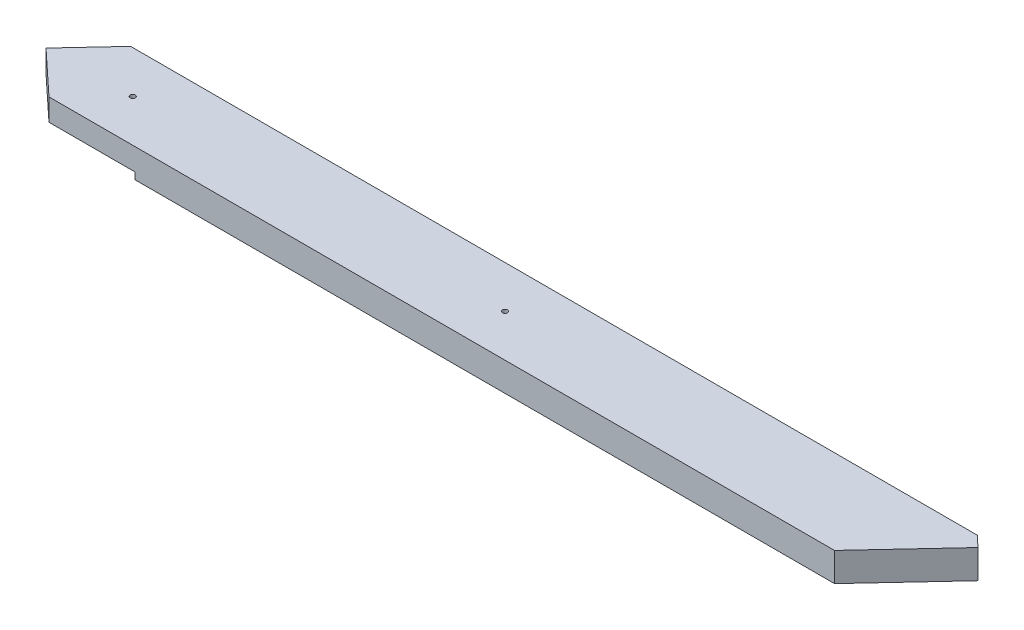
from build123d import *

# Parameters (mm, degrees)
SKETCH1_W           = 1100
SKETCH1_H           = 100
BOSS_EXTRUDE1_DEPTH = 34
SKETCH2_R           = 3
CUT_EXTRUDE1_DEPTH  = 554.313654269
LPATTERN1_COUNT     = 2
LPATTERN1_PITCH     = 440
CUT_EXTRUDE2_DEPTH  = 554.313654269
CUT_EXTRUDE3_DEPTH  = 554.313654269
CUT_EXTRUDE4_DEPTH  = 8


with BuildPart() as part:
    # Sketch1 → Boss-Extrude1 (new body)
    with BuildSketch(Plane(origin=(0, 0, 0), x_dir=(1, 0, 0), z_dir=(0, 1, 0))):
        Rectangle(SKETCH1_W, SKETCH1_H)
    extrude(amount=BOSS_EXTRUDE1_DEPTH)

    # Sketch2 → Cut-Extrude1 (cut, through all)
    with BuildSketch(Plane.XZ):
        with Locations(Location((0, 0, 0), (0, 0, 270))):
            Circle(SKETCH2_R)
    cut_extrude1 = extrude(amount=-CUT_EXTRUDE1_DEPTH, mode=Mode.SUBTRACT)

    # LPattern1: Cut-Extrude1 ×2
    with Locations(*[(-i * LPATTERN1_PITCH, 0, 0) for i in range(1, LPATTERN1_COUNT)]):
        add(cut_extrude1, mode=Mode.SUBTRACT)

    # Sketch5 → Cut-Extrude2 (cut, through all)
    with BuildSketch(Plane(origin=(0, 34, 0), x_dir=(1, 0, 0), z_dir=(0, 1, 0))):
        Polygon((439.548903775, -50), (521.367085593, 37.782601488), (508.259057512, 50), (581.269089668, 128.332351257), (679.928045852, 36.376812481), (491.224130164, -166.083328552), align=None)
    extrude(amount=-CUT_EXTRUDE2_DEPTH, mode=Mode.SUBTRACT)

    # Sketch6 → Cut-Extrude3 (cut, through all)
    with BuildSketch(Plane(origin=(0, 34, 0), x_dir=(1, 0, 0), z_dir=(0, 1, 0))):
        Polygon((-489.021743535, -50), (-540.762594459, -1.774699353), (-492.505745227, 50), (-536.054845889, 101.79865827), (-635.222151443, -14.44064273), (-530.178913575, -116.444679985), align=None)
    extrude(amount=-CUT_EXTRUDE3_DEPTH, mode=Mode.SUBTRACT)

    # Sketch7 → Cut-Extrude4 (cut)
    with BuildSketch(Plane.XZ):
        Polygon((-572.785957212, -266.824534563), (-122.999320006, -233.776208884), (-501.974081863, 172.825230486), (-893.096000672, 137.190691101), align=None)
    extrude(amount=-CUT_EXTRUDE4_DEPTH, mode=Mode.SUBTRACT)


solid = part.part
